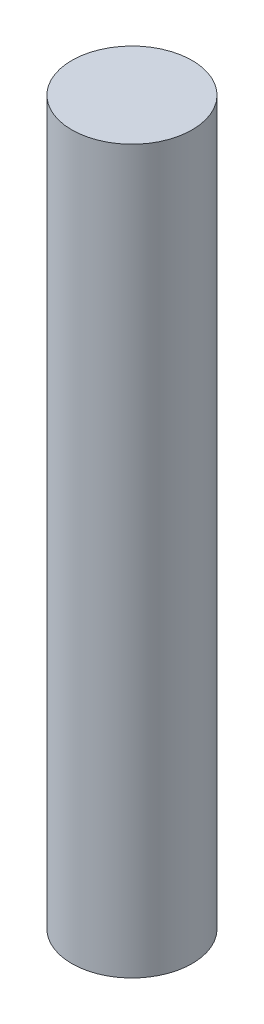
from build123d import *

# Parameters (mm, degrees)
SKETCH_1_R      = 2.5
EXTRUDE_1_DEPTH = 30


with BuildPart() as part:
    # 草图1 → 凸台-拉伸1 (new body)
    with BuildSketch(Plane(origin=(0, 0, 0), x_dir=(1, 0, 0), z_dir=(0, 1, 0))):
        with Locations(Location((0, 0, 0), (0, 0, 270))):
            Circle(SKETCH_1_R)
    extrude(amount=EXTRUDE_1_DEPTH)


solid = part.part
